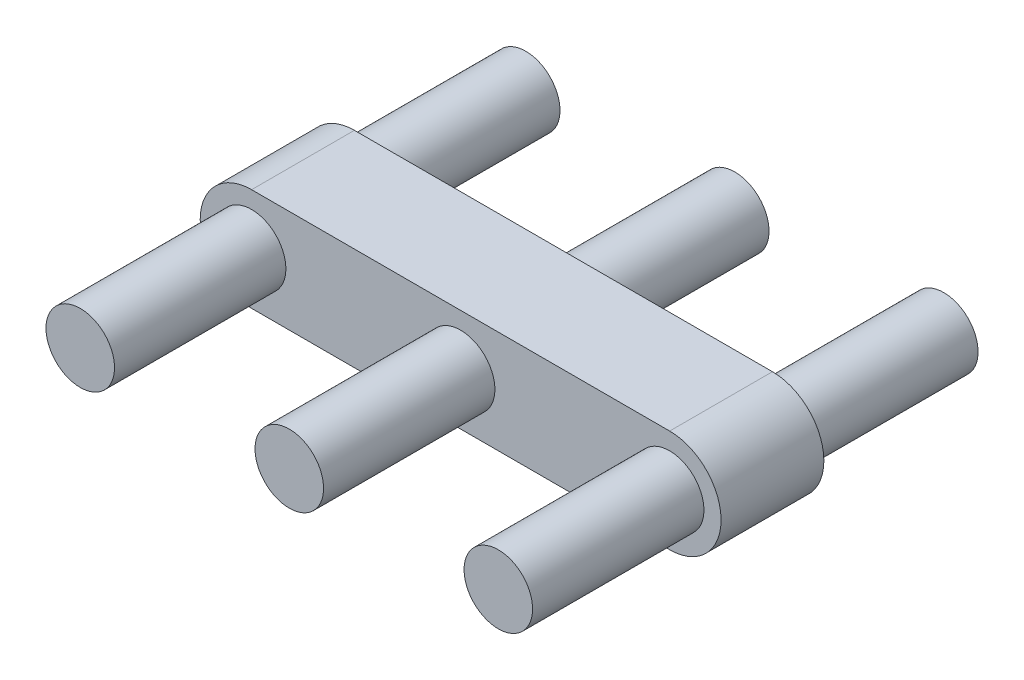
from build123d import *

# Parameters (mm, degrees)
SKETCH1_R           = 1
BOSS_EXTRUDE1_DEPTH = 1.5
SKETCH1_3_R         = 1
BOSS_EXTRUDE2_DEPTH = 6.5


with BuildPart() as part:
    # Sketch1 → Boss-Extrude1 (new, symmetric)
    with BuildSketch(Plane.XY):
        with BuildLine():
            Line((-6.1, -1.5), (6.1, -1.5))
            ThreePointArc((6.1, -1.5), (7.6, 0), (6.1, 1.5))
            Line((6.1, 1.5), (-6.1, 1.5))
            ThreePointArc((-6.1, 1.5), (-7.6, 0), (-6.1, -1.5))
        make_face()
        Circle(SKETCH1_R, mode=Mode.SUBTRACT)
    extrude(amount=BOSS_EXTRUDE1_DEPTH, both=True)

    # Sketch1<3> → Boss-Extrude2 (add, symmetric)
    with BuildSketch(Plane.XY):
        with Locations((-6.1, 0)):
            Circle(SKETCH1_3_R)
        with Locations((6.1, 0)):
            Circle(SKETCH1_3_R)
        Circle(SKETCH1_3_R)
    extrude(amount=BOSS_EXTRUDE2_DEPTH, both=True)


solid = part.part
